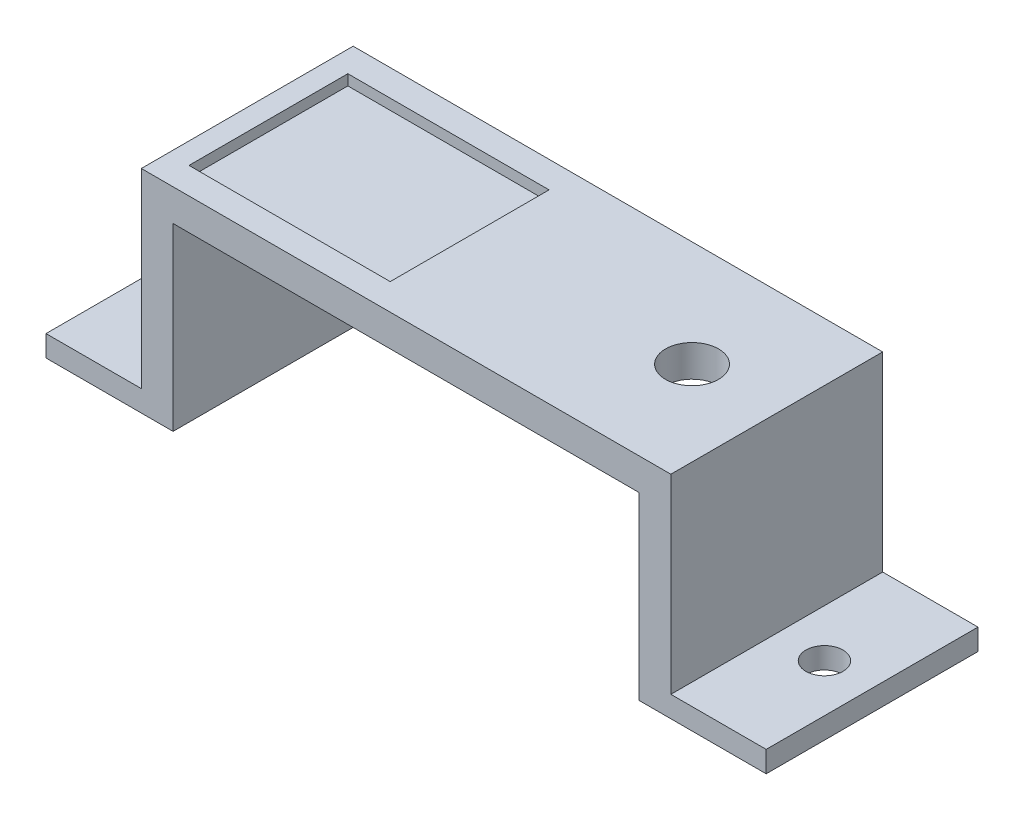
from build123d import *

# Parameters (mm, degrees)
BOSS_EXTRUDE1_DEPTH = 20
SKETCH2_W           = 19
SKETCH2_H           = 15
CUT_EXTRUDE1_DEPTH  = 1
SKETCH3_R           = 2.5
CUT_EXTRUDE2_DEPTH  = 38.749172176
SKETCH4_W           = 9
SKETCH4_H           = 20
BOSS_EXTRUDE2_DEPTH = 2
SKETCH5_R           = 1.75
CUT_EXTRUDE3_DEPTH  = 45.226688775


with BuildPart() as part:
    # Sketch1 → Boss-Extrude1 (new body)
    with BuildSketch(Plane.XY):
        Polygon((22, 0), (22, 17), (-22, 17), (-22, 0), (-25, 0), (-25, 20), (25, 20), (25, 0), align=None)
    extrude(amount=BOSS_EXTRUDE1_DEPTH)

    # Sketch2 → Cut-Extrude1 (cut)
    with BuildSketch(Plane(origin=(0, 20, 0), x_dir=(1, 0, 0), z_dir=(0, 1, 0))):
        with Locations((-13.5, -10)):
            Rectangle(SKETCH2_W, SKETCH2_H)
    extrude(amount=-CUT_EXTRUDE1_DEPTH, mode=Mode.SUBTRACT)

    # Sketch3 → Cut-Extrude2 (cut, through all)
    with BuildSketch(Plane(origin=(0, 20, 0), x_dir=(1, 0, 0), z_dir=(0, 1, 0))):
        with Locations(Location((17, -10, 0), (0, 0, 180))):
            Circle(SKETCH3_R)
    extrude(amount=-CUT_EXTRUDE2_DEPTH, mode=Mode.SUBTRACT)

    # Sketch4 → Boss-Extrude2 (add)
    with BuildSketch(Plane.XZ):
        with Locations((-29.5, 10)):
            Rectangle(SKETCH4_W, SKETCH4_H)
        with Locations((29.5, 10)):
            Rectangle(SKETCH4_W, SKETCH4_H)
    extrude(amount=-BOSS_EXTRUDE2_DEPTH)

    # Sketch5 → Cut-Extrude3 (cut, through all)
    with BuildSketch(Plane.XZ):
        with Locations((-29.5, 10)):
            Circle(SKETCH5_R)
        with Locations((29.5, 10)):
            Circle(SKETCH5_R)
    extrude(amount=-CUT_EXTRUDE3_DEPTH, mode=Mode.SUBTRACT)


solid = part.part
